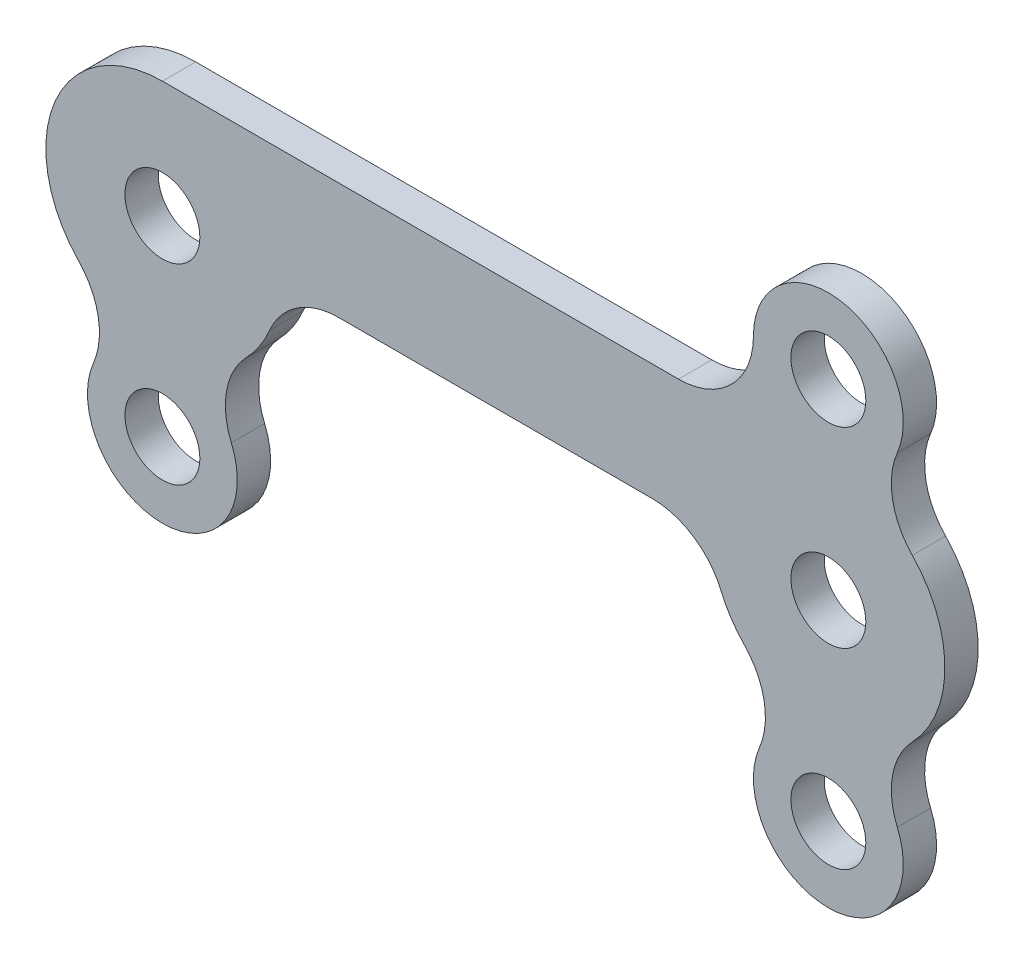
from build123d import *

# Parameters (mm, degrees)
SKETCH1_R           = 1.7859375
SKETCH1_R_2         = 3.571875
BOSS_EXTRUDE1_DEPTH = 1.5875
FILLET1_R           = 3.571875


with BuildPart() as part:
    # Sketch1 → Boss-Extrude1 (new body)
    # profile 1 of 10: a face of its own
    with BuildSketch(Plane.XY):
        with BuildLine():
            Line((5.55625, 0), (26.19375, 0))
            ThreePointArc((26.19375, 0), (27.821137947, -3.928862053), (31.75, -5.55625))
            ThreePointArc((31.75, -5.55625), (37.30625, 0), (31.75, 5.55625))
            Line((31.75, 5.55625), (0, 5.55625))
            ThreePointArc((0, 5.55625), (-5.55625, 0), (0, -5.55625))
            ThreePointArc((0, -5.55625), (3.928862053, -3.928862053), (5.55625, 0))
        make_face()
        Circle(SKETCH1_R, mode=Mode.SUBTRACT)
        with Locations((31.75, 0)):
            Circle(SKETCH1_R, mode=Mode.SUBTRACT)
    # profile 2 of 10: a face of its own
    with BuildSketch(Plane.XY):
        with Locations((0, -9.128125)):
            Circle(SKETCH1_R_2)
        with Locations((0, -9.128125)):
            Circle(SKETCH1_R, mode=Mode.SUBTRACT)
    # profile 3 of 10: a face of its own
    with BuildSketch(Plane.XY):
        with Locations((31.75, -9.128125)):
            Circle(SKETCH1_R_2)
        with Locations((31.75, -9.128125)):
            Circle(SKETCH1_R, mode=Mode.SUBTRACT)
    # profile 4 of 10: a face of its own
    with BuildSketch(Plane.XY):
        with Locations((31.75, 9.128125)):
            Circle(SKETCH1_R_2)
        with Locations((31.75, 9.128125)):
            Circle(SKETCH1_R, mode=Mode.SUBTRACT)
    # profile 5 of 10: a face of its own
    with BuildSketch(Plane.XY):
        with BuildLine():
            ThreePointArc((-3.287058412, -7.730434758), (-1.970522289, -6.148975302), (0, -5.55625))
            ThreePointArc((0, -5.55625), (-2.174184778, -5.113201992), (-4.001636334, -3.85471409))
            ThreePointArc((-4.001636334, -3.85471409), (-3.261499312, -4.9967595), (-3.002241845, -6.332744565))
            ThreePointArc((-3.002241845, -6.332744565), (-3.074170213, -7.04595182), (-3.287058412, -7.730434758))
        make_face()
    # profile 6 of 10: a face of its own
    with BuildSketch(Plane.XY):
        with BuildLine():
            ThreePointArc((3.287058483, -7.730434925), (3.061446625, -5.685103503), (4.001636201, -3.854714228))
            ThreePointArc((4.001636201, -3.854714228), (2.17418469, -5.11320203), (0, -5.55625))
            ThreePointArc((0, -5.55625), (1.970522365, -6.148975352), (3.287058483, -7.730434925))
        make_face()
    # profile 7 of 10: a face of its own
    with BuildSketch(Plane.XY):
        with BuildLine():
            ThreePointArc((31.75, -5.55625), (29.575815234, -5.113201998), (27.748363685, -3.85471411))
            ThreePointArc((27.748363685, -3.85471411), (28.488500694, -4.996759513), (28.747758155, -6.332744565))
            ThreePointArc((28.747758155, -6.332744565), (28.675829783, -7.045951842), (28.46294157, -7.7304348))
            ThreePointArc((28.46294157, -7.7304348), (29.779477692, -6.148975314), (31.75, -5.55625))
        make_face()
    # profile 8 of 10: a face of its own
    with BuildSketch(Plane.XY):
        with BuildLine():
            ThreePointArc((35.751636291, -3.854714135), (33.92418475, -5.113202004), (31.75, -5.55625))
            ThreePointArc((31.75, -5.55625), (33.720522266, -6.148975287), (35.037058391, -7.730434708))
            ThreePointArc((35.037058391, -7.730434708), (34.811446658, -5.685103324), (35.751636291, -3.854714135))
        make_face()
    # profile 9 of 10: a face of its own
    with BuildSketch(Plane.XY):
        with BuildLine():
            ThreePointArc((31.75, 5.55625), (33.924184761, 5.113201999), (35.751636308, 3.854714117))
            ThreePointArc((35.751636308, 3.854714117), (34.811446653, 5.685103353), (35.037058424, 7.730434787))
            ThreePointArc((35.037058424, 7.730434787), (33.720522302, 6.14897531), (31.75, 5.55625))
        make_face()
    # profile 10 of 10: a face of its own
    with BuildSketch(Plane.XY):
        with BuildLine():
            ThreePointArc((28.178125, 9.128125), (27.131947034, 6.602427966), (24.60625, 5.55625))
            Line((24.60625, 5.55625), (31.75, 5.55625))
            ThreePointArc((31.75, 5.55625), (29.224302966, 6.602427966), (28.178125, 9.128125))
        make_face()
    extrude(amount=BOSS_EXTRUDE1_DEPTH)

    # Fillet1
    fillet1_edges = [part.edges().sort_by_distance(p)[0] for p in [
        (26.19375, 0, 0.79375),
        (5.55625, 0, 0.79375),
    ]]
    fillet(fillet1_edges, radius=FILLET1_R)


solid = part.part
